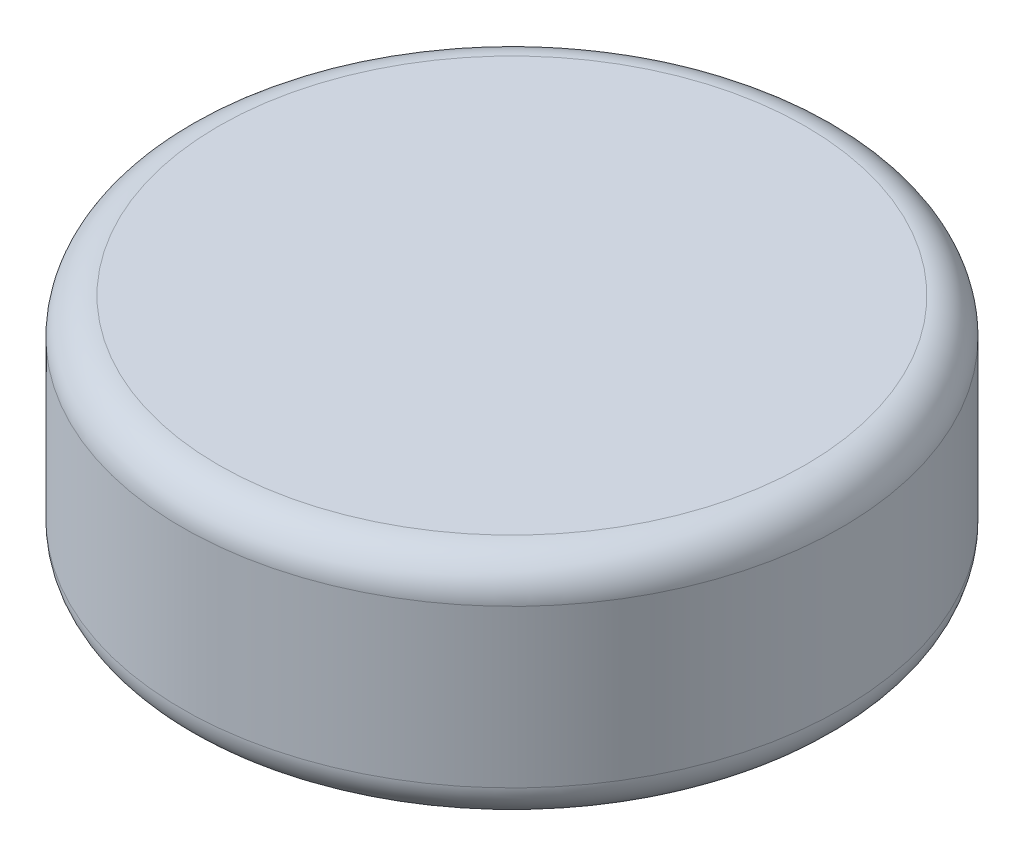
from build123d import *


with BuildPart() as part:
    # Sketch1 → Revolve1 (revolve)
    with BuildSketch(Plane.XY, mode=Mode.PRIVATE) as revolve1_sk:
        with BuildLine():
            Line((0, 0), (0, 12.699432043))
            Line((0, 12.699432043), (16.236891767, 12.699432043))
            ThreePointArc((16.236891767, 12.699432043), (17.651105329, 12.113645606), (18.236891767, 10.699432043))
            Line((18.236891767, 10.699432043), (18.236891767, 2))
            ThreePointArc((18.236891767, 2), (17.651105329, 0.585786438), (16.236891767, 0))
            Line((16.236891767, 0), (0, 0))
        make_face()
    revolve(revolve1_sk.sketch.rotate(Axis((0, 0, 0), (0, 1, 0)), 90), axis=Axis((0, 0, 0), (0, 1, 0)))


solid = part.part
